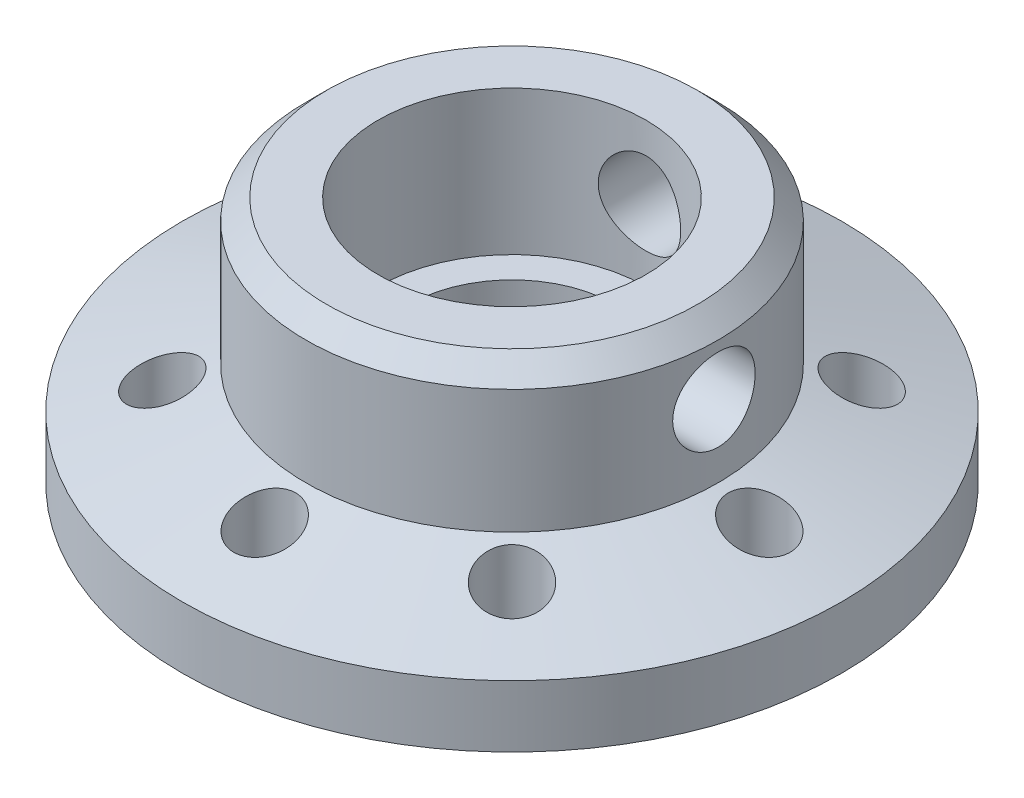
from build123d import *

# Parameters (mm, degrees)
SKETCH2_R          = 1.5
CUT_EXTRUDE1_DEPTH = 10
SKETCH3_R          = 2
CUT_EXTRUDE2_DEPTH = 26.612497075
CIRPATTERN1_COUNT  = 2
CIRPATTERN1_ANGLE  = 90
CHAMFER1_SIZE      = 1


with BuildPart() as part:
    # Sketch1 → Revolve1 (revolve)
    with BuildSketch(Plane.XY, mode=Mode.PRIVATE) as revolve1_sk:
        Polygon((10, 12), (6.5, 12), (6.5, 5), (5, 5), (5, 0), (16, 0), (16, 3), (10, 5), align=None)
    revolve(revolve1_sk.sketch.rotate(Axis((0, 0, 0), (0, 1, 0)), 90), axis=Axis((0, 0, 0), (0, 1, 0)))

    # Sketch2 → Cut-Extrude1 (cut)
    with BuildSketch(Plane.XZ):
        with Locations(Location((0, 12, 0), (0, 0, 270))):
            Circle(SKETCH2_R)
        with Locations(Location((8.485281374, 8.485281374, 0), (0, 0, 270))):
            Circle(SKETCH2_R)
        with Locations(Location((12, 0, 0), (0, 0, 270))):
            Circle(SKETCH2_R)
        with Locations(Location((8.485281374, -8.485281374, 0), (0, 0, 270))):
            Circle(SKETCH2_R)
        with Locations(Location((0, -12, 0), (0, 0, 270))):
            Circle(SKETCH2_R)
        with Locations(Location((-8.485281374, -8.485281374, 0), (0, 0, 270))):
            Circle(SKETCH2_R)
        with Locations(Location((-12, 0, 0), (0, 0, 270))):
            Circle(SKETCH2_R)
        with Locations(Location((-8.485281374, 8.485281374, 0), (0, 0, 270))):
            Circle(SKETCH2_R)
    extrude(amount=-CUT_EXTRUDE1_DEPTH, mode=Mode.SUBTRACT)

    # Sketch3 → Cut-Extrude2 (cut, through all)
    with BuildSketch(Plane.XY):
        with Locations(Location((0, 8.5, 0), (0, 0, 270.000000001))):
            Circle(SKETCH3_R)
    cut_extrude2 = extrude(amount=-CUT_EXTRUDE2_DEPTH, mode=Mode.SUBTRACT)

    # CirPattern1: Cut-Extrude2 ×2 about axis
    cirpattern1_axis = Axis((0, 12, 0), (0, -1, 0))
    for i in range(1, CIRPATTERN1_COUNT):
        add(cut_extrude2.rotate(cirpattern1_axis, i * CIRPATTERN1_ANGLE / (CIRPATTERN1_COUNT - 1)), mode=Mode.SUBTRACT)

    # Chamfer1
    chamfer1_edges = [part.edges().sort_by_distance(p)[0] for p in [
        (0, 12, 10),
    ]]
    chamfer(chamfer1_edges, length=CHAMFER1_SIZE)


solid = part.part
